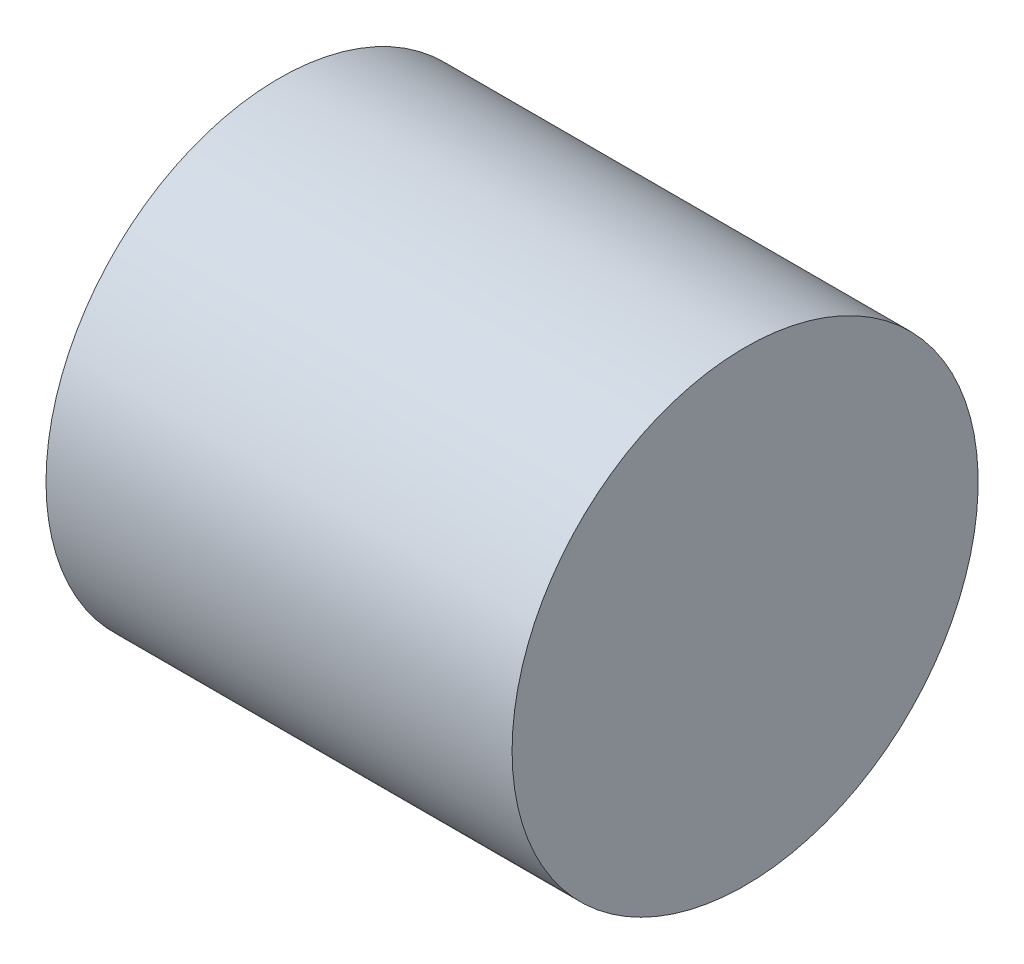
from build123d import *

# Parameters (mm, degrees)
SKETCH1_W = 584.2
SKETCH1_H = 292.1


with BuildPart() as part:
    # Sketch1 → Revolve1 (revolve)
    with BuildSketch(Plane.XY, mode=Mode.PRIVATE) as revolve1_sk:
        with Locations((292.1, 146.05)):
            Rectangle(SKETCH1_W, SKETCH1_H)
    revolve(revolve1_sk.sketch.rotate(Axis((0, 0, 0), (1, 0, 0)), 90), axis=Axis((0, 0, 0), (1, 0, 0)))


solid = part.part
